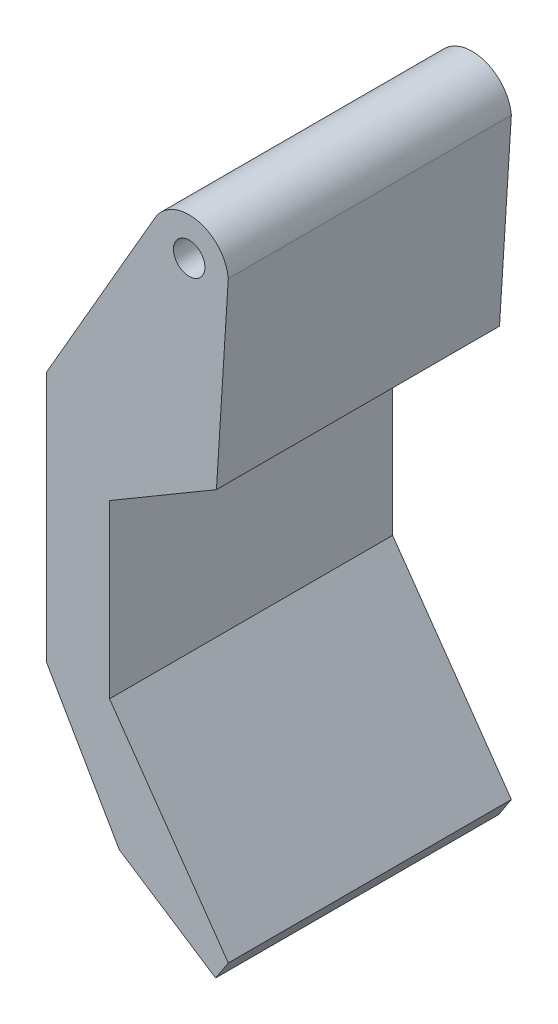
from build123d import *

# Parameters (mm, degrees)
EXTRUDE_4_DEPTH     = 45
SKETCH_2_R          = 2.5
CUT_EXTRUDE_1_DEPTH = 85.798913103


with BuildPart() as part:
    # 草图1 → 凸台-拉伸4 (new body)
    with BuildSketch(Plane.XY):
        with BuildLine():
            ThreePointArc((11.999755772, 64.190702015), (7.19287537, 69.699227744), (0.441332655, 66.894477154))
            Line((0.441332655, 66.894477154), (-16.87917542, 36.894477154))
            Line((-16.87917542, 36.894477154), (-16.87917542, -3.105522846))
            Line((-16.87917542, -3.105522846), (-5.332170037, -23.105522846))
            Line((-5.332170037, -23.105522846), (9.992741519, -33.105522846))
            Line((9.992741519, -33.105522846), (11.999755772, -30.029791253))
            Line((11.999755772, -30.029791253), (-6.87917542, -3.105522846))
            Line((-6.87917542, -3.105522846), (-6.87917542, 14.190702015))
            Line((-6.87917542, 14.190702015), (-6.87917542, 24.190702015))
            Line((-6.87917542, 24.190702015), (10.114332844, 34.190702015))
            Line((10.114332844, 34.190702015), (11.999755772, 64.190702015))
        make_face()
    extrude(amount=EXTRUDE_4_DEPTH)

    # 草图2 → 切除-拉伸1 (cut, through all)
    with BuildSketch(Plane.XY):
        with Locations(Location((5.784422652, 63.881230161, 0), (0, 0, 180))):
            Circle(SKETCH_2_R)
    extrude(amount=CUT_EXTRUDE_1_DEPTH, mode=Mode.SUBTRACT)


solid = part.part
